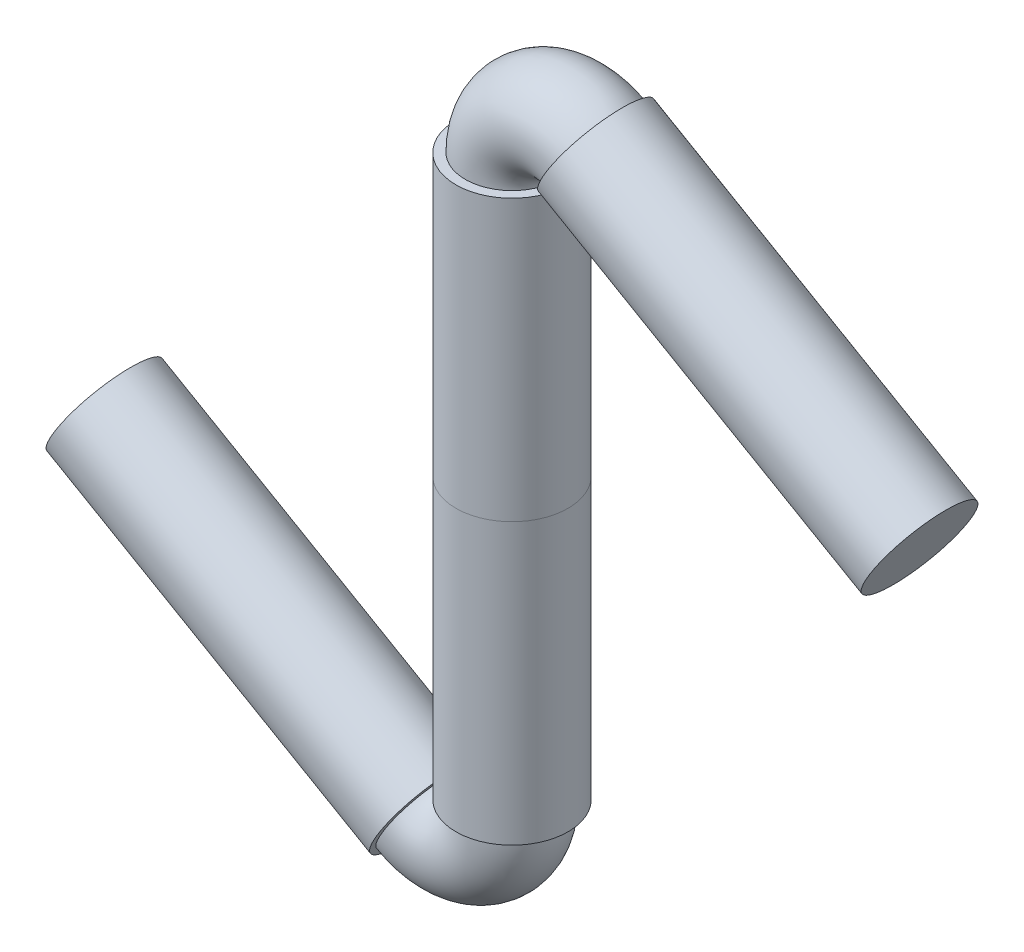
from build123d import *

# Parameters (mm, degrees)
SKETCH_1_R      = 15
EXTRUDE_1_DEPTH = 75
SKETCH_10_R     = 12.5
SKETCH_13_R     = 14
EXTRUDE_7_DEPTH = 100


with BuildPart() as part:
    # 草图1 → 凸台-拉伸1 (new body)
    with BuildSketch(Plane(origin=(0, 0, 0), x_dir=(1, 0, 0), z_dir=(0, 1, 0))):
        with Locations(Location((0, 0, 0), (0, 0, 270))):
            Circle(SKETCH_1_R)
    extrude(amount=EXTRUDE_1_DEPTH)

    # 扫描1: sweep along a path in 草图9
    with BuildLine(Plane.XY) as sweep_1_path:
        ThreePointArc((0, 75), (7.5, 87.990381057), (22.5, 87.990381057))
    # 草图10 → 扫描1 (sweep)
    with BuildSketch(Plane(origin=(-21.225952642, 12.254809472, 0), x_dir=(0, 0, 1), z_dir=(-0.8660254037844399, 0.4999999999999978, 0))):
        with Locations((0, 87.451905284)):
            Circle(SKETCH_10_R)
    sweep(path=sweep_1_path.line)

    # 草图13 → 凸台-拉伸7 (add)
    with BuildSketch(Plane(origin=(-21.225952642, 12.254809472, 0), x_dir=(0, 0, -1), z_dir=(0.86602540378444, -0.49999999999999784, 0))):
        with Locations(Location((0, 87.451905284, 0), (0, 0, 90))):
            Circle(SKETCH_13_R)
    extrude(amount=EXTRUDE_7_DEPTH)


with BuildPart() as body_2:
    # 镜向14: mirrored copy
    add(part.part.mirror(Plane.ZX))


with BuildPart() as body_3:
    # 镜向15: mirrored copy
    add(body_2.part.mirror(Plane(origin=(0, 0, 0), x_dir=(0, 0, 1), z_dir=(1, 0, 0))))


solid = Compound([part.part, body_3.part])
